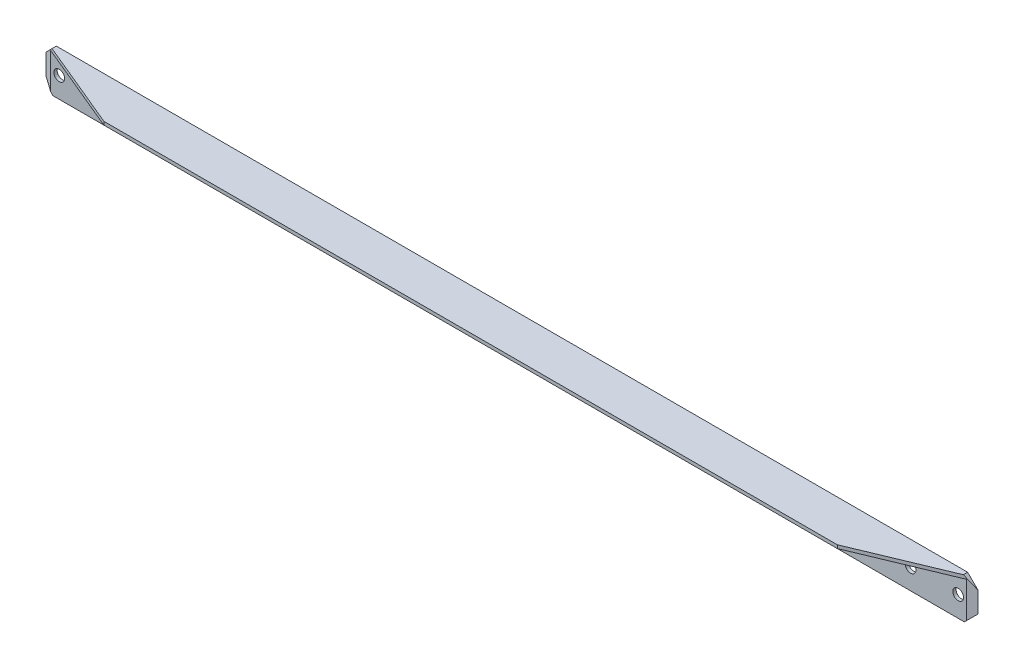
from build123d import *

# Parameters (mm, degrees)
SKETCH_1_W          = 2252
SKETCH_1_H          = 100
SKETCH_1_R          = 13
EXTRUDE_1_DEPTH     = 8
SKETCH_2_W          = 2252
SKETCH_2_H          = 8
EXTRUDE_2_DEPTH     = 92
CHAMFER_3_SIZE      = 25
CHAMFER_4_SIZE      = 25
CUT_EXTRUDE_3_DEPTH = 1135.846245092
CHAMFER_5_SIZE      = 25
CHAMFER_6_SIZE      = 25


with BuildPart() as part:
    # 草图1 → 凸台-拉伸1 (new body)
    with BuildSketch(Plane.XY):
        with Locations((0, 50)):
            Rectangle(SKETCH_1_W, SKETCH_1_H)
        with Locations((1086, 50)):
            Circle(SKETCH_1_R, mode=Mode.SUBTRACT)
        with Locations((971, 50)):
            Circle(SKETCH_1_R, mode=Mode.SUBTRACT)
        with Locations((0, 50)):
            Circle(SKETCH_1_R, mode=Mode.SUBTRACT)
        with Locations((80, 50)):
            Circle(SKETCH_1_R, mode=Mode.SUBTRACT)
        with Locations((160, 50)):
            Circle(SKETCH_1_R, mode=Mode.SUBTRACT)
        with Locations(Location((-80, 50, 0), (0, 0, 180))):
            Circle(SKETCH_1_R, mode=Mode.SUBTRACT)
        with Locations(Location((-160, 50, 0), (0, 0, 180))):
            Circle(SKETCH_1_R, mode=Mode.SUBTRACT)
        with Locations(Location((-971, 50, 0), (0, 0, 180))):
            Circle(SKETCH_1_R, mode=Mode.SUBTRACT)
        with Locations(Location((-1086, 50, 0), (0, 0, 180))):
            Circle(SKETCH_1_R, mode=Mode.SUBTRACT)
    extrude(amount=EXTRUDE_1_DEPTH)

    # 草图2 → 凸台-拉伸2 (add)
    with BuildSketch(Plane.XY.offset(8)):
        with Locations((0, 96)):
            Rectangle(SKETCH_2_W, SKETCH_2_H)
    extrude(amount=EXTRUDE_2_DEPTH)

    # 倒角3
    chamfer_3_edges = [part.edges().sort_by_distance(p)[0] for p in [
        (1126, 0, 4),
    ]]
    chamfer(chamfer_3_edges, length=CHAMFER_3_SIZE)

    # 倒角4
    chamfer_4_edges = [part.edges().sort_by_distance(p)[0] for p in [
        (1126, 100, 50),
    ]]
    chamfer(chamfer_4_edges, length=CHAMFER_4_SIZE)

    # 草图3 → 切除-拉伸3 (cut, through all)
    with BuildSketch(Plane(origin=(0, 100, 0), x_dir=(1, 0, 0), z_dir=(0, 1, 0))):
        Polygon((886, -100), (1126, 0), (1126, -100), align=None)
    cut_extrude_3 = extrude(amount=-CUT_EXTRUDE_3_DEPTH, mode=Mode.SUBTRACT)

    # 倒角5
    chamfer_5_edges = [part.edges().sort_by_distance(p)[0] for p in [
        (-1126, 0, 4),
    ]]
    chamfer(chamfer_5_edges, length=CHAMFER_5_SIZE)

    # 倒角6
    chamfer_6_edges = [part.edges().sort_by_distance(p)[0] for p in [
        (-1126, 100, 50),
    ]]
    chamfer(chamfer_6_edges, length=CHAMFER_6_SIZE)

    # 镜向8: 切除-拉伸3 across plane
    add(cut_extrude_3.mirror(Plane(origin=(0, 0, 0), x_dir=(0, 0, 1), z_dir=(1, 0, 0))), mode=Mode.SUBTRACT)


solid = part.part
